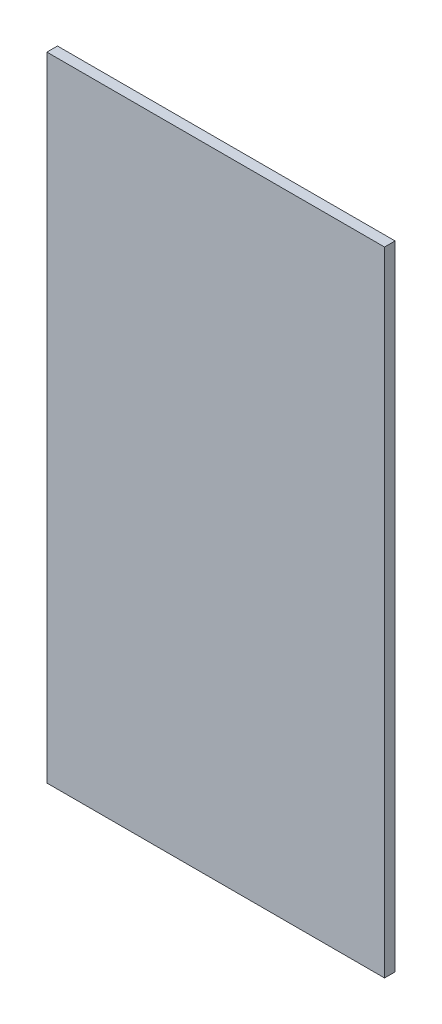
from build123d import *

# Parameters (mm, degrees)
SKETCH1_W           = 203.2
SKETCH1_H           = 381
BOSS_EXTRUDE2_DEPTH = 6.35


with BuildPart() as part:
    # Sketch1 → Boss-Extrude2 (new body)
    with BuildSketch(Plane.XY):
        with Locations((-413.289613734, -481.689742489)):
            Rectangle(SKETCH1_W, SKETCH1_H)
    extrude(amount=BOSS_EXTRUDE2_DEPTH)


solid = part.part
